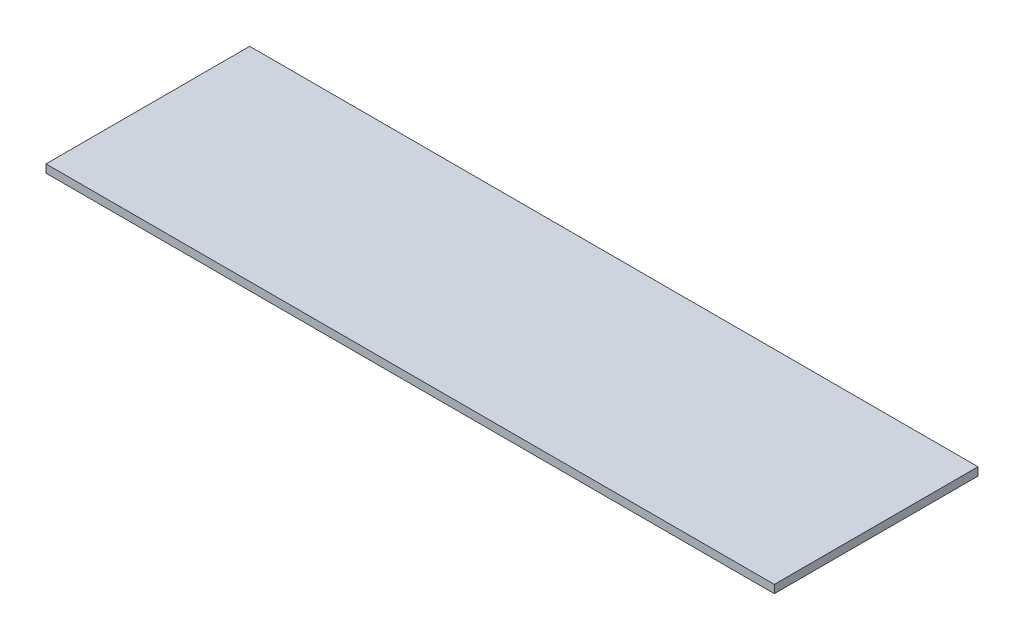
from build123d import *

# Parameters (mm, degrees)
SKETCH1_W           = 900
SKETCH1_H           = 251.7
BOSS_EXTRUDE1_DEPTH = 5


with BuildPart() as part:
    # Sketch1 → Boss-Extrude1 (new, symmetric)
    with BuildSketch(Plane(origin=(0, 0, 0), x_dir=(1, 0, 0), z_dir=(0, 1, 0))):
        Rectangle(SKETCH1_W, SKETCH1_H)
    extrude(amount=BOSS_EXTRUDE1_DEPTH, both=True)


solid = part.part
